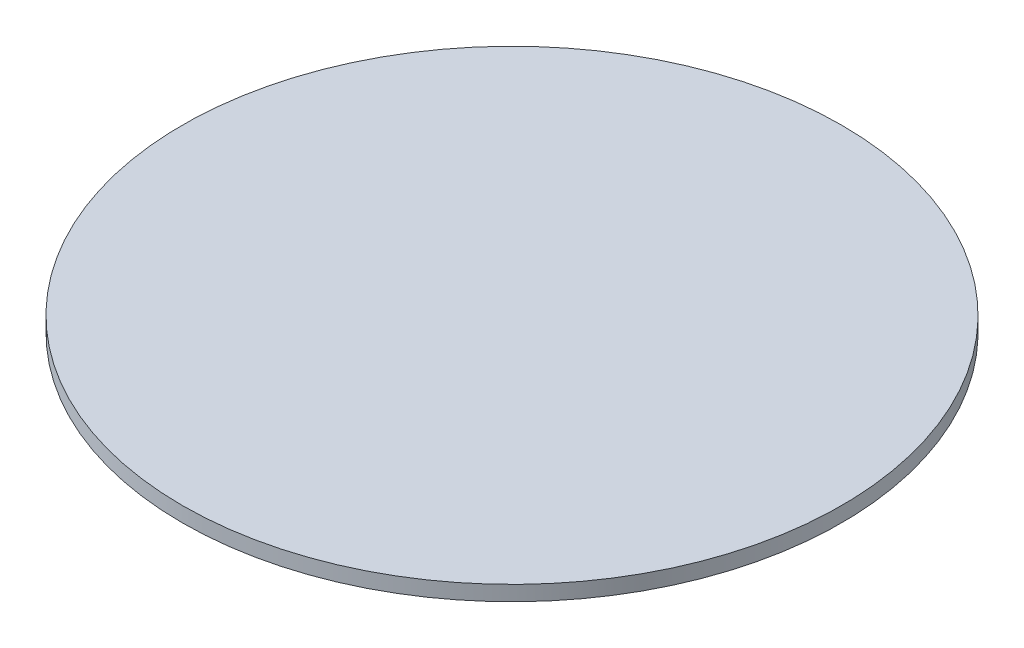
from build123d import *

# Parameters (mm, degrees)
SKETCH1_R           = 55.662835588
BOSS_EXTRUDE1_DEPTH = 2.54


with BuildPart() as part:
    # Sketch1 → Boss-Extrude1 (new body)
    with BuildSketch(Plane(origin=(0, 0, 0), x_dir=(1, 0, 0), z_dir=(0, 1, 0))):
        with Locations(Location((0, 0, 0), (0, 0, 270))):
            Circle(SKETCH1_R)
    extrude(amount=BOSS_EXTRUDE1_DEPTH)


solid = part.part
